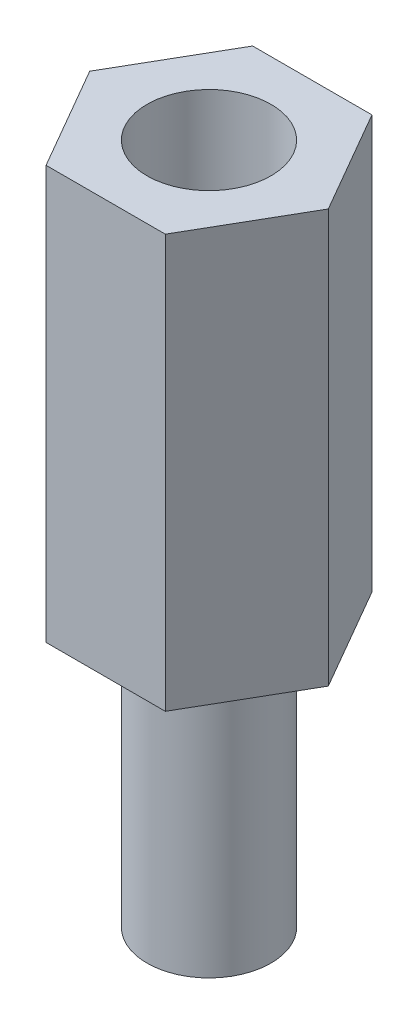
from build123d import *

# Parameters (mm, degrees)
SKETCH_1_R          = 1.5
EXTRUDE_1_DEPTH     = 6.5
EXTRUDE_2_DEPTH     = 10
CUT_EXTRUDE_START   = -6.5
SKETCH_3_R          = 1.5
CUT_EXTRUDE_1_DEPTH = 6.5


with BuildPart() as part:
    # ｽｹｯﾁ1 → ﾎﾞｽ - 押し出し1 (new body)
    with BuildSketch(Plane(origin=(0, 0, 0), x_dir=(1, 0, 0), z_dir=(0, 1, 0))):
        with Locations(Location((0, 0, 0), (0, 0, 90))):
            Circle(SKETCH_1_R)
    extrude(amount=EXTRUDE_1_DEPTH)

    # ｽｹｯﾁ2 → ﾎﾞｽ - 押し出し2 (add)
    with BuildSketch(Plane(origin=(0, 6.5, 0), x_dir=(1, 0, 0), z_dir=(0, 1, 0))):
        Polygon((1.443375673, -2.5), (2.886751346, 0), (1.443375673, 2.5), (-1.443375673, 2.5), (-2.886751346, 0), (-1.443375673, -2.5), align=None)
    extrude(amount=EXTRUDE_2_DEPTH)

    # ｽｹｯﾁ3 → ｶｯﾄ - 押し出し1 (cut)
    with BuildSketch(Plane(origin=(0, 16.5, 0), x_dir=(1, 0, 0), z_dir=(0, 1, 0)).offset(CUT_EXTRUDE_START)):
        with Locations(Location((0, 0, 0), (0, 0, 90))):
            Circle(SKETCH_3_R)
    extrude(amount=CUT_EXTRUDE_1_DEPTH, mode=Mode.SUBTRACT)


solid = part.part
